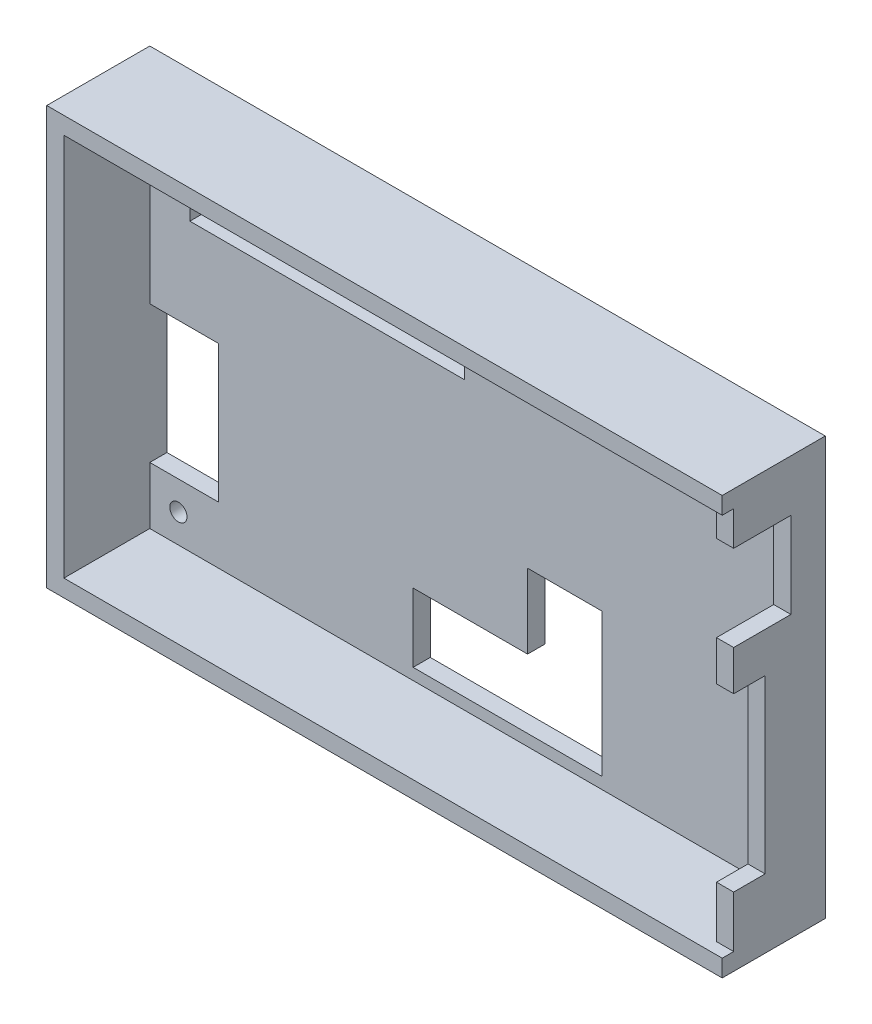
from build123d import *

# Parameters (mm, degrees)
SKETCH_1_W          = 118
SKETCH_1_H          = 73
SKETCH_1_R          = 1.5
EXTRUDE_1_DEPTH     = 3
EXTRUDE_2_DEPTH     = 15
SKETCH_3_W          = 3
SKETCH_3_H          = 6
EXTRUDE_3_DEPTH     = 13
SKETCH_4_W          = 3
SKETCH_4_H          = 15
EXTRUDE_4_DEPTH     = 3
SKETCH_5_W          = 3
SKETCH_5_H          = 30
EXTRUDE_5_DEPTH     = 7.5
SKETCH_7_W          = 12
SKETCH_7_H          = 24
CUT_EXTRUDE_2_DEPTH = 3
SKETCH_6_W          = 48
SKETCH_6_H          = 10.5
CUT_EXTRUDE_4_DEPTH = 3


with BuildPart() as part:
    # 草图1 → 凸台-拉伸1 (new body)
    with BuildSketch(Plane.XY):
        with Locations((26.824038132, -3.814969101)):
            Rectangle(SKETCH_1_W, SKETCH_1_H)
        with Locations((-24.175961868, 24.685030899)):
            Circle(SKETCH_1_R, mode=Mode.SUBTRACT)
        with Locations((-24.175961868, -32.314969101)):
            Circle(SKETCH_1_R, mode=Mode.SUBTRACT)
        with Locations((77.824038132, 24.685030899)):
            Circle(SKETCH_1_R, mode=Mode.SUBTRACT)
        with Locations((77.824038132, -32.314969101)):
            Circle(SKETCH_1_R, mode=Mode.SUBTRACT)
    extrude(amount=EXTRUDE_1_DEPTH)

    # 草图2 → 凸台-拉伸2 (add)
    with BuildSketch(Plane.XY.offset(3)):
        Polygon((-32.175961868, 32.685030899), (-32.175961868, 29.685030899), (-32.175961868, -37.314969101), (-32.175961868, -40.314969101), (85.824038132, -40.314969101), (85.824038132, -37.314969101), (-29.175961868, -37.314969101), (-29.175961868, 29.685030899), (85.824038132, 29.685030899), (85.824038132, 32.685030899), align=None)
    extrude(amount=EXTRUDE_2_DEPTH)

    # 草图3 → 凸台-拉伸3 (add)
    with BuildSketch(Plane.XY.offset(3)):
        Polygon((85.824038132, 3.618173266), (85.824038132, 8.685030899), (82.824038132, 8.685030899), (82.824038132, 1.685030899), (85.824038132, 1.685030899), align=None)
        with Locations((84.324038132, 26.685030899)):
            Rectangle(SKETCH_3_W, SKETCH_3_H)
        Polygon((85.824038132, -37.314969101), (85.824038132, -28.314969101), (85.2282411, -28.314969101), (82.824038132, -28.314969101), (82.824038132, -37.314969101), align=None)
    extrude(amount=EXTRUDE_3_DEPTH)

    # 草图4 → 凸台-拉伸4 (add)
    with BuildSketch(Plane.XY.offset(3)):
        with Locations((84.324038132, 16.185030899)):
            Rectangle(SKETCH_4_W, SKETCH_4_H)
    extrude(amount=EXTRUDE_4_DEPTH)

    # 草图5 → 凸台-拉伸5 (add)
    with BuildSketch(Plane.XY.offset(3)):
        with Locations((84.324038132, -13.314969101)):
            Rectangle(SKETCH_5_W, SKETCH_5_H)
    extrude(amount=EXTRUDE_5_DEPTH)

    # 草图7 → 切除-拉伸2 (cut)
    with BuildSketch(Plane.XY.offset(3)):
        Polygon((16.824038132, -35.314969101), (16.824038132, -23.314969101), (36.824038132, -23.314969101), (36.824038132, -10.314969101), (49.824038132, -10.314969101), (49.824038132, -35.314969101), align=None)
        with Locations((-23.175961868, -15.314969101)):
            Rectangle(SKETCH_7_W, SKETCH_7_H)
    extrude(amount=-CUT_EXTRUDE_2_DEPTH, mode=Mode.SUBTRACT)

    # 草图6 → 切除-拉伸4 (cut)
    with BuildSketch(Plane.XY.offset(3)):
        with Locations((1.824038132, 17.935030899)):
            Rectangle(SKETCH_6_W, SKETCH_6_H)
    extrude(amount=-CUT_EXTRUDE_4_DEPTH, mode=Mode.SUBTRACT)


solid = part.part
